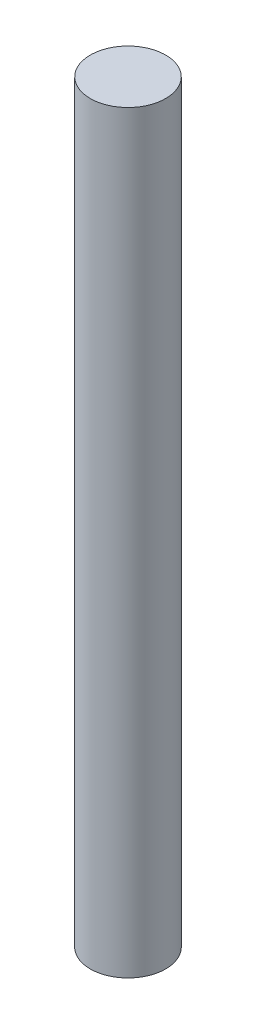
from build123d import *

# Parameters (mm, degrees)
SKETCH1_R      = 10
EXTRUDE1_DEPTH = 200


with BuildPart() as part:
    # Sketch1 → Extrude1 (new body)
    with BuildSketch(Plane(origin=(0, 0, 0), x_dir=(1, 0, 0), z_dir=(0, 1, 0))):
        with Locations(Location((0, 0, 0), (0, 0, 270))):
            Circle(SKETCH1_R)
    extrude(amount=EXTRUDE1_DEPTH)


solid = part.part
